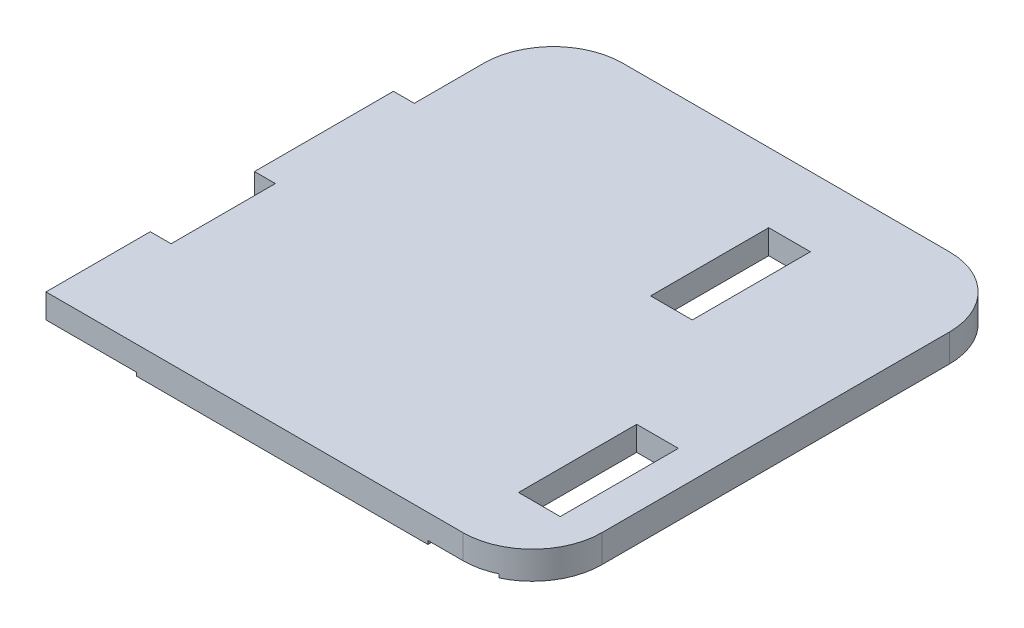
from build123d import *

# Parameters (mm, degrees)
SKETCH1_W           = 0.6
SKETCH1_H           = 1.7
BOSS_EXTRUDE1_DEPTH = 0.4
FILLET1_R           = 1
SKETCH2_W           = 1.728090014
SKETCH2_H           = 7
CUT_EXTRUDE1_DEPTH  = 0.05


with BuildPart() as part:
    # Sketch1 → Boss-Extrude1 (new body)
    with BuildSketch(Plane(origin=(0, 0, 0), x_dir=(1, 0, 0), z_dir=(0, 1, 0))):
        Polygon((0, 0), (7, 0), (7, 7), (0.3, 7), (0.3, 5), (0, 5), (0, 3), (0.3, 3), (0.3, 1.5), (0, 1.5), align=None)
        with Locations((4.7, 5.15)):
            Rectangle(SKETCH1_W, SKETCH1_H, mode=Mode.SUBTRACT)
        with Locations((6.2, 1.75)):
            Rectangle(SKETCH1_W, SKETCH1_H, mode=Mode.SUBTRACT)
    extrude(amount=BOSS_EXTRUDE1_DEPTH)

    # Fillet1
    fillet1_edges = [part.edges().sort_by_distance(p)[0] for p in [
        (0.3, 0.2, -7),
        (7, 0.2, -7),
        (7, 0.2, 0),
    ]]
    fillet(fillet1_edges, radius=FILLET1_R)

    # Sketch2 → Cut-Extrude1 (cut)
    with BuildSketch(Plane.XZ):
        with BuildLine():
            Line((5, -6), (4.891522781, -6))
            Line((4.891522781, -6), (4.891522781, -7.295431915))
            Line((4.891522781, -7.295431915), (4.07762411, -7.295431915))
            Line((4.07762411, -7.295431915), (4.07762411, -4.178910814))
            ThreePointArc((4.07762411, -4.178910814), (4.156244956, -3.909764741), (4.367382545, -3.725260636))
            Line((4.367382545, -3.725260636), (5.20570378, -3.336745481))
            ThreePointArc((5.20570378, -3.336745481), (5.416841369, -3.152241376), (5.495462215, -2.883095303))
            Line((5.495462215, -2.883095303), (5.495462215, 0.578390888))
            Line((5.495462215, 0.578390888), (6.425754314, 0.578390888))
            Line((6.425754314, 0.578390888), (6.425754314, -0.9))
            Line((6.425754314, -0.9), (6.5, -0.9))
            Line((6.5, -0.9), (6.5, -2.6))
            Line((6.5, -2.6), (6.425754314, -2.6))
            Line((6.425754314, -2.6), (6.425754314, -3.345351228))
            ThreePointArc((6.425754314, -3.345351228), (6.344600523, -3.618422378), (6.127482902, -3.802850492))
            Line((6.127482902, -3.802850492), (5, -4.3))
            Line((5, -4.3), (5, -6))
        make_face()
        with Locations((0.435954993, -3.5)):
            Rectangle(SKETCH2_W, SKETCH2_H)
    extrude(amount=-CUT_EXTRUDE1_DEPTH, mode=Mode.SUBTRACT)


solid = part.part
